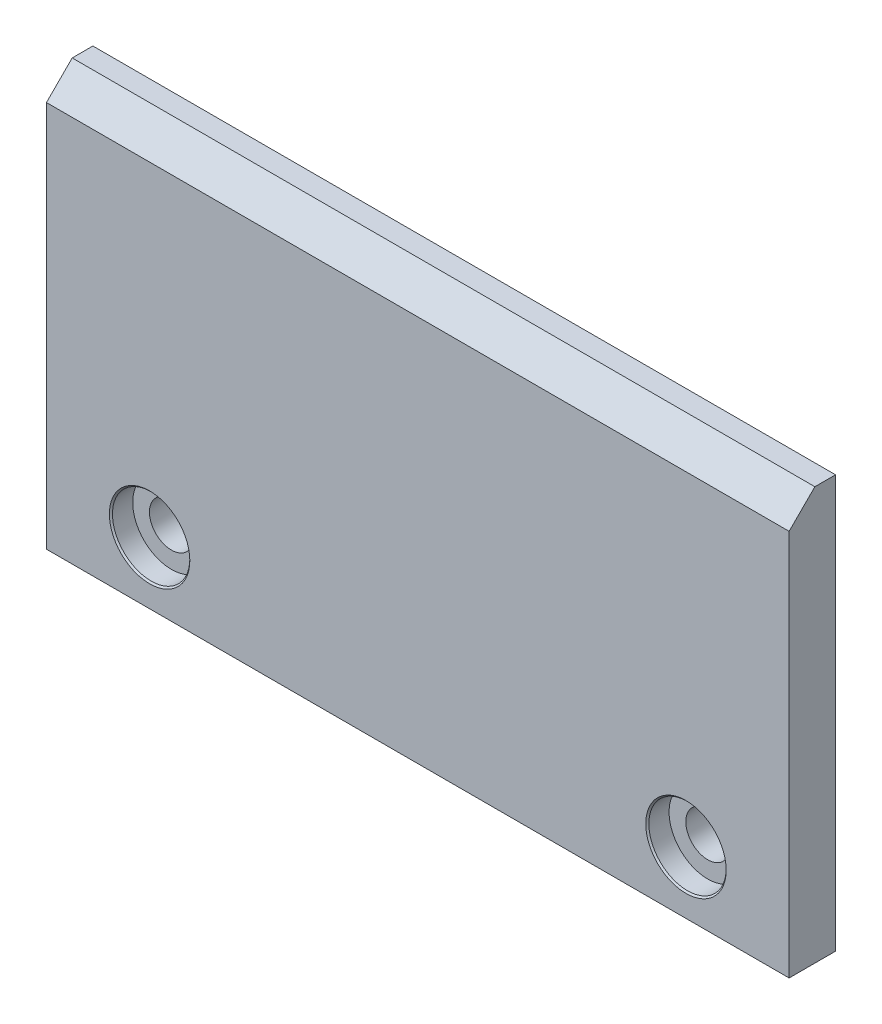
from build123d import *

# Parameters (mm, degrees)
SKETCH2_W                                     = 7.14375
SKETCH2_H                                     = 63.5
BOSS_EXTRUDE1_DEPTH                           = 114.3
CBORE_FOR_1_4_BUTTON_HEAD_CAP_SCREW1_AT_COUNT = 2
CBORE_FOR_1_4_BUTTON_HEAD_CAP_SCREW1_AT_PITCH = 82.55
CHAMFER1_SIZE                                 = 3.9624


with BuildPart() as part:
    # Sketch2 → Boss-Extrude1 (new body)
    with BuildSketch(Plane(origin=(0, 0, 0), x_dir=(0, 0, -1), z_dir=(1, 0, 0))):
        with Locations((3.571875, 31.75)):
            Rectangle(SKETCH2_W, SKETCH2_H)
    extrude(amount=-BOSS_EXTRUDE1_DEPTH)

    # Sketch3 → CBORE for 1/4 Button Head Cap Screw1 (revolve, cut)
    with BuildSketch(Plane(origin=(-98.425, 9.525, 0), x_dir=(0, -1, 0), z_dir=(1, 0, 0))):
        Polygon((0, 0), (0, 7.14375), (3.3782, 7.14375), (3.3782, 3.3528), (5.95376, 3.3528), (5.95376, 0.23749), (6.19125, 0), align=None)
    cbore_for_1_4_button_head_cap_screw1 = revolve(axis=Axis((-98.425, 9.525, 6.35), (0, 0, -1)), mode=Mode.SUBTRACT)

    # CBORE for 1/4 Button Head Cap Screw1 at: CBORE for 1/4 Button Head Cap Screw1 ×2
    with Locations(*[(i * CBORE_FOR_1_4_BUTTON_HEAD_CAP_SCREW1_AT_PITCH, 0, 0) for i in range(1, CBORE_FOR_1_4_BUTTON_HEAD_CAP_SCREW1_AT_COUNT)]):
        add(cbore_for_1_4_button_head_cap_screw1, mode=Mode.SUBTRACT)

    # Chamfer1
    chamfer1_edges = [part.edges().sort_by_distance(p)[0] for p in [
        (-57.15, 63.5, 0),
    ]]
    chamfer(chamfer1_edges, length=CHAMFER1_SIZE)


solid = part.part
